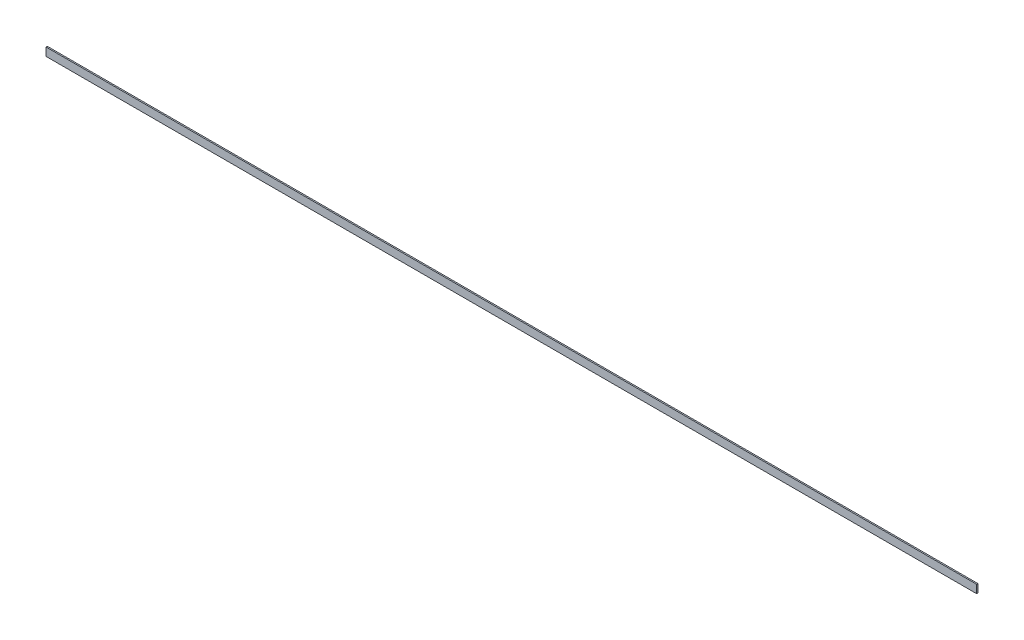
from build123d import *

# Parameters (mm, degrees)
SKETCH1_W           = 512.80120964
SKETCH1_H           = 4.5
BOSS_EXTRUDE1_DEPTH = 0.7


with BuildPart() as part:
    # Sketch1 → Boss-Extrude1 (new body)
    with BuildSketch(Plane.XY):
        with Locations((47.82269369, 41.546366547)):
            Rectangle(SKETCH1_W, SKETCH1_H)
    extrude(amount=BOSS_EXTRUDE1_DEPTH)


solid = part.part
